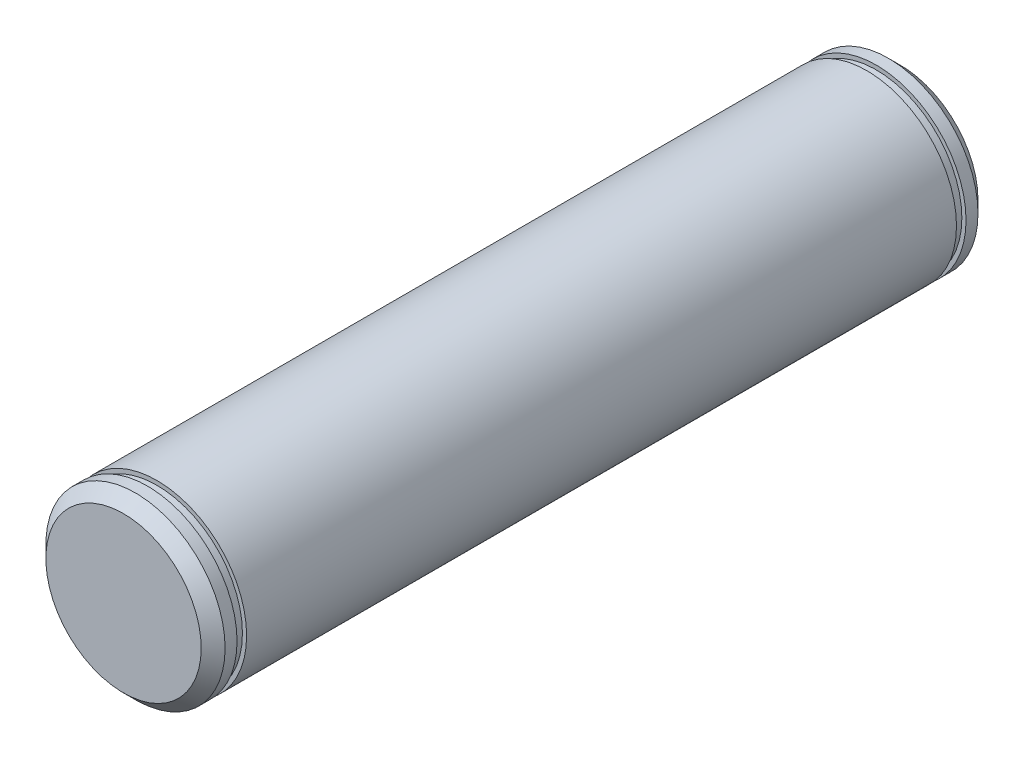
from build123d import *

# Parameters (mm, degrees)
SKETCH1_R           = 15
BOSS_EXTRUDE1_DEPTH = 130
CHAMFER1_SIZE       = 2
SKETCH2_W           = 1.6
SKETCH2_H           = 0.7


with BuildPart() as part:
    # Sketch1 → Boss-Extrude1 (new body)
    with BuildSketch(Plane.XY):
        Circle(SKETCH1_R)
    extrude(amount=BOSS_EXTRUDE1_DEPTH)

    # Chamfer1
    chamfer1_edges = [part.edges().sort_by_distance(p)[0] for p in [
        (-15, 0, 0),
        (-15, 0, 130),
    ]]
    chamfer(chamfer1_edges, length=CHAMFER1_SIZE)

    # Sketch2 → Cut-Revolve1 (revolve, cut)
    with BuildSketch(Plane(origin=(0, 0, 0), x_dir=(0, 0, -1), z_dir=(1, 0, 0)), mode=Mode.PRIVATE) as cut_revolve1_sk:
        with Locations((-125.2, 14.65)):
            Rectangle(SKETCH2_W, SKETCH2_H)
        with Locations((-4.8, 14.65)):
            Rectangle(SKETCH2_W, SKETCH2_H)
    revolve(cut_revolve1_sk.sketch.rotate(Axis((0, 0, 130), (0, 0, -1)), 90), axis=Axis((0, 0, 130), (0, 0, -1)), mode=Mode.SUBTRACT)


solid = part.part
